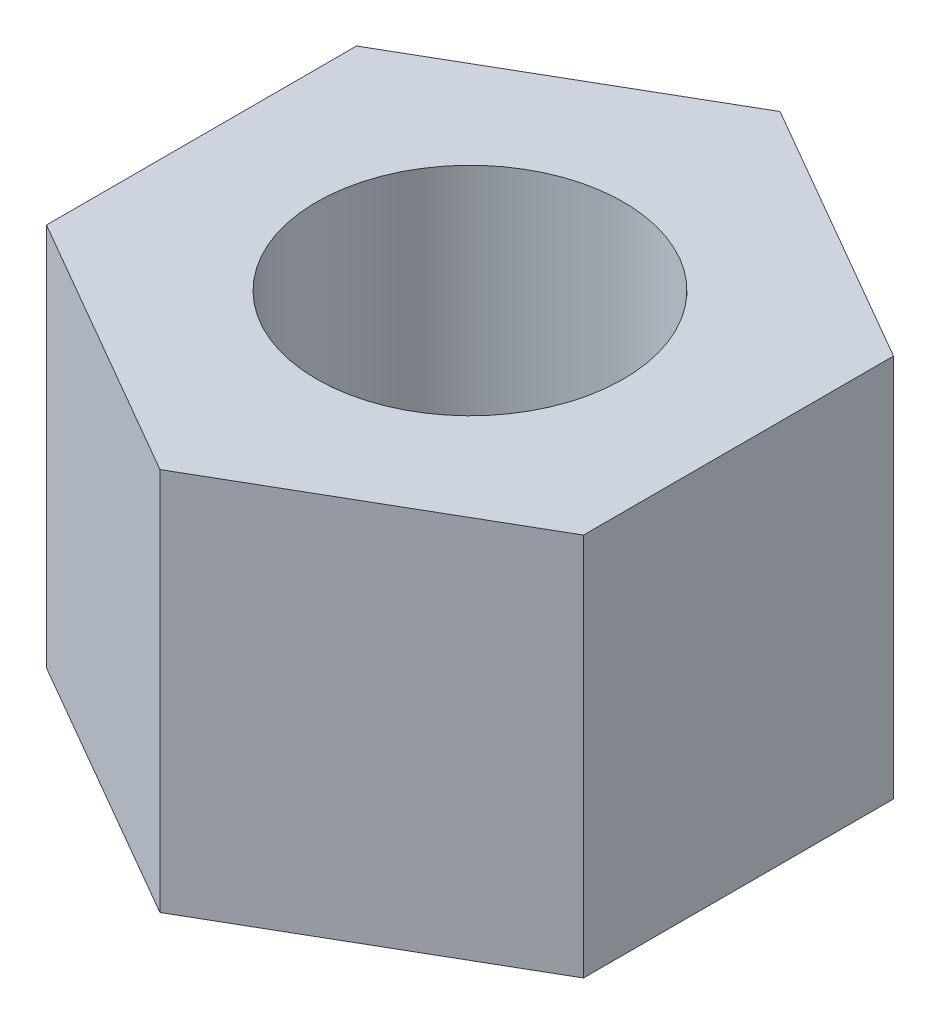
from build123d import *

# Parameters (mm, degrees)
SKETCH_1_R      = 2
EXTRUDE_1_DEPTH = 5


with BuildPart() as part:
    # 草图1 → 凸台-拉伸1 (new body)
    with BuildSketch(Plane(origin=(0, 0, 0), x_dir=(1, 0, 0), z_dir=(0, 1, 0))):
        Polygon((0, 4.041451884), (-3.5, 2.020725942), (-3.5, -2.020725942), (0, -4.041451884), (3.5, -2.020725942), (3.5, 2.020725942), align=None)
        with Locations(Location((0, 0, 0), (0, 0, 270))):
            Circle(SKETCH_1_R, mode=Mode.SUBTRACT)
    extrude(amount=EXTRUDE_1_DEPTH)


solid = part.part
